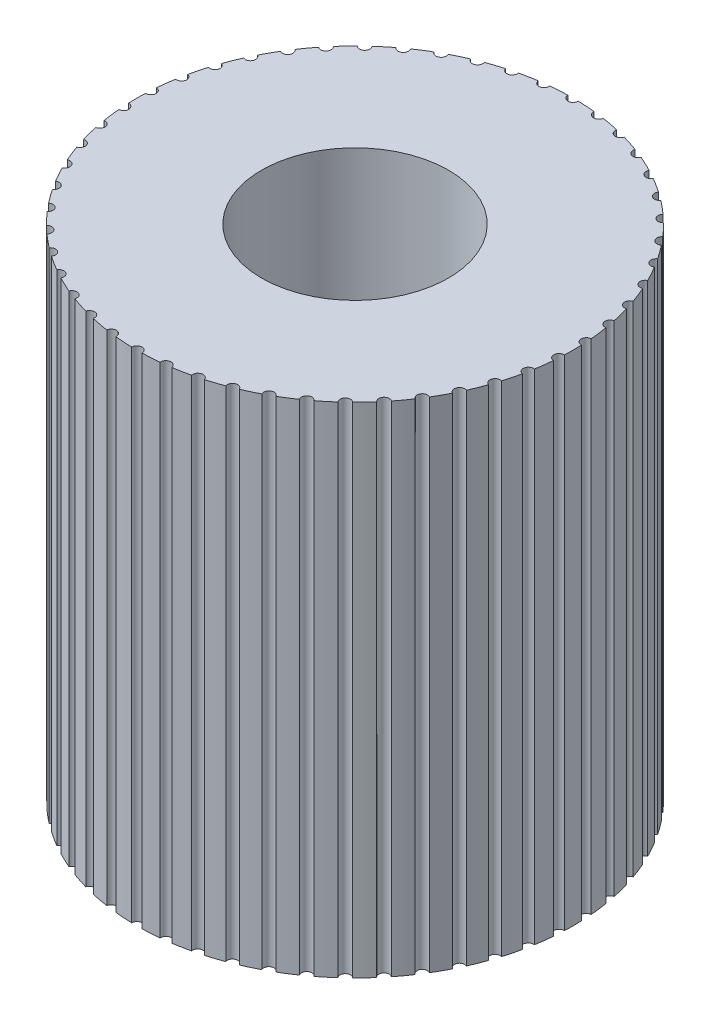
from build123d import *

# Parameters (mm, degrees)
SKETCH1_R       = 5.25
SKETCH1_R_2     = 2.25
MAIN_BODY_DEPTH = 12
CUT_DEPTH       = 15.111165792
CUT_DEPTH_BACK  = 15.111165792
SKETCH3_R       = 0.125


with BuildPart() as part:
    # Sketch1 → Main Body (new body)
    with BuildSketch(Plane(origin=(0, 0, 0), x_dir=(1, 0, 0), z_dir=(0, 1, 0))):
        with Locations(Location((0, 0, 0), (0, 0, 270))):
            Circle(SKETCH1_R)
        with Locations(Location((0, 0, 0), (0, 0, 270))):
            Circle(SKETCH1_R_2, mode=Mode.SUBTRACT)
    extrude(amount=MAIN_BODY_DEPTH)

    # Sketch3 → Cut (cut, two sides: drawn at the far end of the back side and taken through both)
    with BuildSketch(Plane(origin=(0, 12, 0), x_dir=(1, 0, 0), z_dir=(0, 1, 0)).offset(-CUT_DEPTH_BACK)):
        with Locations((0, 5.25)):
            Circle(SKETCH3_R)
        with Locations((0.657999476, 5.208602182)):
            Circle(SKETCH3_R)
        with Locations((1.305621908, 5.085061596)):
            Circle(SKETCH3_R)
        with Locations((1.932653902, 4.881326551)):
            Circle(SKETCH3_R)
        with Locations((2.529206789, 4.60061007)):
            Circle(SKETCH3_R)
        with Locations((3.085872575, 4.24733922)):
            Circle(SKETCH3_R)
        with Locations((3.593872306, 3.827085294)):
            Circle(SKETCH3_R)
        with Locations((4.045194525, 3.346475946)):
            Circle(SKETCH3_R)
        with Locations((4.432721609, 2.813090674)):
            Circle(SKETCH3_R)
        with Locations((4.750342025, 2.235341281)):
            Circle(SKETCH3_R)
        with Locations((4.993046711, 1.62233922)):
            Circle(SKETCH3_R)
        with Locations((5.157008066, 0.983751902)):
            Circle(SKETCH3_R)
        with Locations((5.239640324, 0.329650228)):
            Circle(SKETCH3_R)
        with Locations((5.239640324, -0.329650228)):
            Circle(SKETCH3_R)
        with Locations((5.157008066, -0.983751902)):
            Circle(SKETCH3_R)
        with Locations((4.993046711, -1.62233922)):
            Circle(SKETCH3_R)
        with Locations((4.750342025, -2.235341281)):
            Circle(SKETCH3_R)
        with Locations((4.432721609, -2.813090674)):
            Circle(SKETCH3_R)
        with Locations((4.045194525, -3.346475946)):
            Circle(SKETCH3_R)
        with Locations((3.593872306, -3.827085294)):
            Circle(SKETCH3_R)
        with Locations((3.085872575, -4.24733922)):
            Circle(SKETCH3_R)
        with Locations((2.529206789, -4.60061007)):
            Circle(SKETCH3_R)
        with Locations((1.932653902, -4.881326551)):
            Circle(SKETCH3_R)
        with Locations((1.305621908, -5.085061596)):
            Circle(SKETCH3_R)
        with Locations((0.657999476, -5.208602182)):
            Circle(SKETCH3_R)
        with Locations((0, -5.25)):
            Circle(SKETCH3_R)
        with Locations((-0.657999476, -5.208602182)):
            Circle(SKETCH3_R)
        with Locations((-1.305621908, -5.085061596)):
            Circle(SKETCH3_R)
        with Locations((-1.932653902, -4.881326551)):
            Circle(SKETCH3_R)
        with Locations((-2.529206789, -4.60061007)):
            Circle(SKETCH3_R)
        with Locations((-3.085872575, -4.24733922)):
            Circle(SKETCH3_R)
        with Locations((-3.593872306, -3.827085294)):
            Circle(SKETCH3_R)
        with Locations((-4.045194525, -3.346475946)):
            Circle(SKETCH3_R)
        with Locations((-4.432721609, -2.813090674)):
            Circle(SKETCH3_R)
        with Locations((-4.750342025, -2.235341281)):
            Circle(SKETCH3_R)
        with Locations((-4.993046711, -1.62233922)):
            Circle(SKETCH3_R)
        with Locations((-5.157008066, -0.983751902)):
            Circle(SKETCH3_R)
        with Locations((-5.239640324, -0.329650228)):
            Circle(SKETCH3_R)
        with Locations((-5.239640324, 0.329650228)):
            Circle(SKETCH3_R)
        with Locations((-5.157008066, 0.983751902)):
            Circle(SKETCH3_R)
        with Locations((-4.993046711, 1.62233922)):
            Circle(SKETCH3_R)
        with Locations((-4.750342025, 2.235341281)):
            Circle(SKETCH3_R)
        with Locations((-4.432721609, 2.813090674)):
            Circle(SKETCH3_R)
        with Locations((-4.045194525, 3.346475946)):
            Circle(SKETCH3_R)
        with Locations((-3.593872306, 3.827085294)):
            Circle(SKETCH3_R)
        with Locations((-3.085872575, 4.24733922)):
            Circle(SKETCH3_R)
        with Locations((-2.529206789, 4.60061007)):
            Circle(SKETCH3_R)
        with Locations((-1.932653902, 4.881326551)):
            Circle(SKETCH3_R)
        with Locations((-1.305621908, 5.085061596)):
            Circle(SKETCH3_R)
        with Locations((-0.657999476, 5.208602182)):
            Circle(SKETCH3_R)
    extrude(amount=CUT_DEPTH + CUT_DEPTH_BACK, mode=Mode.SUBTRACT)


solid = part.part
